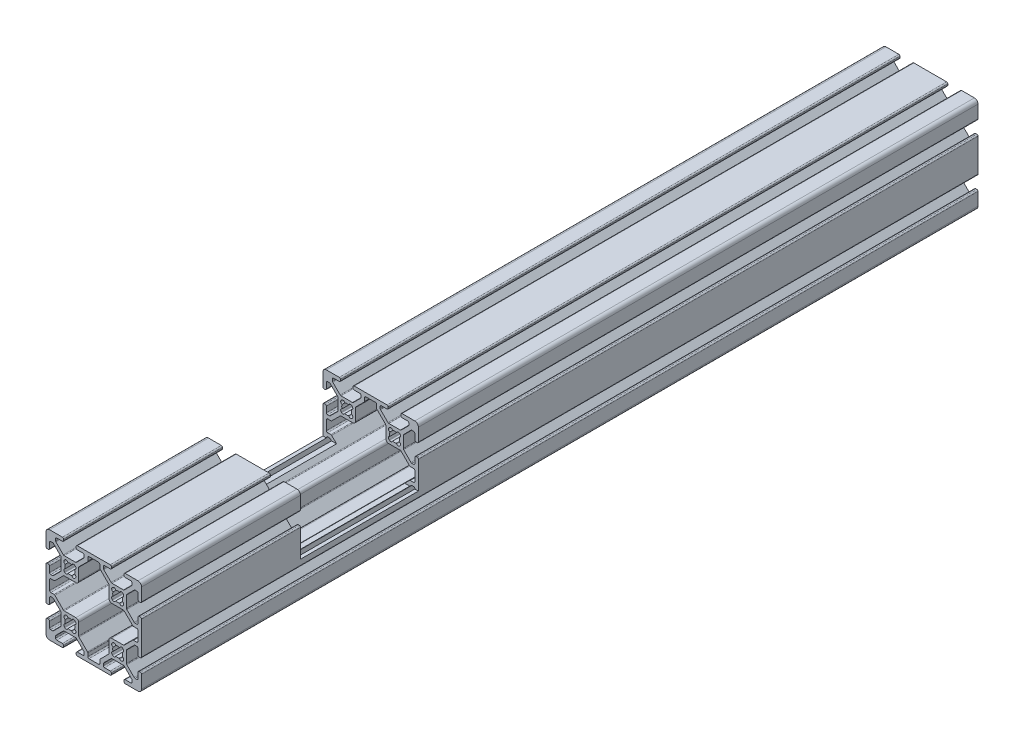
from build123d import *

# Parameters (mm, degrees)
EXTRUDE1_DEPTH     = 350
SKETCH2_W          = 49.355199135
SKETCH2_H          = 28.504685617
CUT_EXTRUDE1_DEPTH = 54


with BuildPart() as part:
    # Sketch1 → Extrude1 (new body)
    with BuildSketch(Plane.XY):
        with BuildLine():
            Line((-22.383919339, -3.655), (-17.616080661, -3.655))
            ThreePointArc((-17.616080661, -3.655), (-17.421677478, -3.693669197), (-17.256870417, -3.803789755))
            Line((-17.256870417, -3.803789755), (-14.153789755, -6.906870417))
            ThreePointArc((-14.153789755, -6.906870417), (-14.043669197, -7.071677478), (-14.005, -7.266080661))
            Line((-14.005, -7.266080661), (-14.005, -7.992))
            ThreePointArc((-14.005, -7.992), (-14.153789755, -8.351210245), (-14.513, -8.5))
            Line((-14.513, -8.5), (-16.862, -8.5))
            ThreePointArc((-16.862, -8.5), (-17.221210245, -8.648789755), (-17.37, -9.008))
            Line((-17.37, -9.008), (-17.37, -9.492))
            ThreePointArc((-17.37, -9.492), (-17.221210245, -9.851210245), (-16.862, -10))
            Line((-16.862, -10), (-3.138, -10))
            ThreePointArc((-3.138, -10), (-2.778789755, -9.851210245), (-2.63, -9.492))
            Line((-2.63, -9.492), (-2.63, -9.008))
            ThreePointArc((-2.63, -9.008), (-2.778789755, -8.648789755), (-3.138, -8.5))
            Line((-3.138, -8.5), (-5.487, -8.5))
            ThreePointArc((-5.487, -8.5), (-5.846210245, -8.351210245), (-5.995, -7.992))
            Line((-5.995, -7.992), (-5.995, -7.266080661))
            ThreePointArc((-5.995, -7.266080661), (-5.956330803, -7.071677478), (-5.846210245, -6.906870417))
            Line((-5.846210245, -6.906870417), (-2.743129583, -3.803789755))
            ThreePointArc((-2.743129583, -3.803789755), (-2.578322522, -3.693669197), (-2.383919339, -3.655))
            Line((-2.383919339, -3.655), (2.383919339, -3.655))
            ThreePointArc((2.383919339, -3.655), (2.578322522, -3.693669197), (2.743129583, -3.803789755))
            Line((2.743129583, -3.803789755), (5.846210245, -6.906870417))
            ThreePointArc((5.846210245, -6.906870417), (5.956330803, -7.071677478), (5.995, -7.266080661))
            Line((5.995, -7.266080661), (5.995, -7.992))
            ThreePointArc((5.995, -7.992), (5.846210245, -8.351210245), (5.487, -8.5))
            Line((5.487, -8.5), (3.138, -8.5))
            ThreePointArc((3.138, -8.5), (2.778789755, -8.648789755), (2.63, -9.008))
            Line((2.63, -9.008), (2.63, -9.492))
            ThreePointArc((2.63, -9.492), (2.778789755, -9.851210245), (3.138, -10))
            Line((3.138, -10), (8.5, -10))
            ThreePointArc((8.5, -10), (9.560660172, -9.560660172), (10, -8.5))
            Line((10, -8.5), (10, -3.138))
            ThreePointArc((10, -3.138), (9.851210245, -2.778789755), (9.492, -2.63))
            Line((9.492, -2.63), (9.008, -2.63))
            ThreePointArc((9.008, -2.63), (8.648789755, -2.778789755), (8.5, -3.138))
            Line((8.5, -3.138), (8.5, -5.487))
            ThreePointArc((8.5, -5.487), (8.351210245, -5.846210245), (7.992, -5.995))
            Line((7.992, -5.995), (7.266080661, -5.995))
            ThreePointArc((7.266080661, -5.995), (7.071677478, -5.956330803), (6.906870417, -5.846210245))
            Line((6.906870417, -5.846210245), (3.803789755, -2.743129583))
            ThreePointArc((3.803789755, -2.743129583), (3.693669197, -2.578322522), (3.655, -2.383919339))
            Line((3.655, -2.383919339), (3.655, 2.383919339))
            ThreePointArc((3.655, 2.383919339), (3.693669197, 2.578322522), (3.803789755, 2.743129583))
            Line((3.803789755, 2.743129583), (6.906870417, 5.846210245))
            ThreePointArc((6.906870417, 5.846210245), (7.071677478, 5.956330803), (7.266080661, 5.995))
            Line((7.266080661, 5.995), (7.992, 5.995))
            ThreePointArc((7.992, 5.995), (8.351210245, 5.846210245), (8.5, 5.487))
            Line((8.5, 5.487), (8.5, 3.138))
            ThreePointArc((8.5, 3.138), (8.648789755, 2.778789755), (9.008, 2.63))
            Line((9.008, 2.63), (9.492, 2.63))
            ThreePointArc((9.492, 2.63), (9.851210245, 2.778789755), (10, 3.138))
            Line((10, 3.138), (10, 16.862))
            ThreePointArc((10, 16.862), (9.851210245, 17.221210245), (9.492, 17.37))
            Line((9.492, 17.37), (9.008, 17.37))
            ThreePointArc((9.008, 17.37), (8.648789755, 17.221210245), (8.5, 16.862))
            Line((8.5, 16.862), (8.5, 14.513))
            ThreePointArc((8.5, 14.513), (8.351210245, 14.153789755), (7.992, 14.005))
            Line((7.992, 14.005), (7.266080661, 14.005))
            ThreePointArc((7.266080661, 14.005), (7.071677478, 14.043669197), (6.906870417, 14.153789755))
            Line((6.906870417, 14.153789755), (3.803789755, 17.256870417))
            ThreePointArc((3.803789755, 17.256870417), (3.693669197, 17.421677478), (3.655, 17.616080661))
            Line((3.655, 17.616080661), (3.655, 22.383919339))
            ThreePointArc((3.655, 22.383919339), (3.693669197, 22.578322522), (3.803789755, 22.743129583))
            Line((3.803789755, 22.743129583), (6.906870417, 25.846210245))
            ThreePointArc((6.906870417, 25.846210245), (7.071677478, 25.956330803), (7.266080661, 25.995))
            Line((7.266080661, 25.995), (7.992, 25.995))
            ThreePointArc((7.992, 25.995), (8.351210245, 25.846210245), (8.5, 25.487))
            Line((8.5, 25.487), (8.5, 23.138))
            ThreePointArc((8.5, 23.138), (8.648789755, 22.778789755), (9.008, 22.63))
            Line((9.008, 22.63), (9.492, 22.63))
            ThreePointArc((9.492, 22.63), (9.851210245, 22.778789755), (10, 23.138))
            Line((10, 23.138), (10, 28.5))
            ThreePointArc((10, 28.5), (9.560660172, 29.560660172), (8.5, 30))
            Line((8.5, 30), (3.138, 30))
            ThreePointArc((3.138, 30), (2.778789755, 29.851210245), (2.63, 29.492))
            Line((2.63, 29.492), (2.63, 29.008))
            ThreePointArc((2.63, 29.008), (2.778789755, 28.648789755), (3.138, 28.5))
            Line((3.138, 28.5), (5.487, 28.5))
            ThreePointArc((5.487, 28.5), (5.846210245, 28.351210245), (5.995, 27.992))
            Line((5.995, 27.992), (5.995, 27.266080661))
            ThreePointArc((5.995, 27.266080661), (5.956330803, 27.071677478), (5.846210245, 26.906870417))
            Line((5.846210245, 26.906870417), (2.743129583, 23.803789755))
            ThreePointArc((2.743129583, 23.803789755), (2.578322522, 23.693669197), (2.383919339, 23.655))
            Line((2.383919339, 23.655), (-2.383919339, 23.655))
            ThreePointArc((-2.383919339, 23.655), (-2.578322522, 23.693669197), (-2.743129583, 23.803789755))
            Line((-2.743129583, 23.803789755), (-5.846210245, 26.906870417))
            ThreePointArc((-5.846210245, 26.906870417), (-5.956330803, 27.071677478), (-5.995, 27.266080661))
            Line((-5.995, 27.266080661), (-5.995, 27.992))
            ThreePointArc((-5.995, 27.992), (-5.846210245, 28.351210245), (-5.487, 28.5))
            Line((-5.487, 28.5), (-3.138, 28.5))
            ThreePointArc((-3.138, 28.5), (-2.778789755, 28.648789755), (-2.63, 29.008))
            Line((-2.63, 29.008), (-2.63, 29.492))
            ThreePointArc((-2.63, 29.492), (-2.778789755, 29.851210245), (-3.138, 30))
            Line((-3.138, 30), (-16.862, 30))
            ThreePointArc((-16.862, 30), (-17.221210245, 29.851210245), (-17.37, 29.492))
            Line((-17.37, 29.492), (-17.37, 29.008))
            ThreePointArc((-17.37, 29.008), (-17.221210245, 28.648789755), (-16.862, 28.5))
            Line((-16.862, 28.5), (-14.513, 28.5))
            ThreePointArc((-14.513, 28.5), (-14.153789755, 28.351210245), (-14.005, 27.992))
            Line((-14.005, 27.992), (-14.005, 27.266080661))
            ThreePointArc((-14.005, 27.266080661), (-14.043669197, 27.071677478), (-14.153789755, 26.906870417))
            Line((-14.153789755, 26.906870417), (-17.256870417, 23.803789755))
            ThreePointArc((-17.256870417, 23.803789755), (-17.421677478, 23.693669197), (-17.616080661, 23.655))
            Line((-17.616080661, 23.655), (-22.383919339, 23.655))
            ThreePointArc((-22.383919339, 23.655), (-22.578322522, 23.693669197), (-22.743129583, 23.803789755))
            Line((-22.743129583, 23.803789755), (-25.846210245, 26.906870417))
            ThreePointArc((-25.846210245, 26.906870417), (-25.956330803, 27.071677478), (-25.995, 27.266080661))
            Line((-25.995, 27.266080661), (-25.995, 27.992))
            ThreePointArc((-25.995, 27.992), (-25.846210245, 28.351210245), (-25.487, 28.5))
            Line((-25.487, 28.5), (-23.138, 28.5))
            ThreePointArc((-23.138, 28.5), (-22.778789755, 28.648789755), (-22.63, 29.008))
            Line((-22.63, 29.008), (-22.63, 29.492))
            ThreePointArc((-22.63, 29.492), (-22.778789755, 29.851210245), (-23.138, 30))
            Line((-23.138, 30), (-28.5, 30))
            ThreePointArc((-28.5, 30), (-29.560660172, 29.560660172), (-30, 28.5))
            Line((-30, 28.5), (-30, 23.138))
            ThreePointArc((-30, 23.138), (-29.851210245, 22.778789755), (-29.492, 22.63))
            Line((-29.492, 22.63), (-29.008, 22.63))
            ThreePointArc((-29.008, 22.63), (-28.648789755, 22.778789755), (-28.5, 23.138))
            Line((-28.5, 23.138), (-28.5, 25.487))
            ThreePointArc((-28.5, 25.487), (-28.351210245, 25.846210245), (-27.992, 25.995))
            Line((-27.992, 25.995), (-27.266080661, 25.995))
            ThreePointArc((-27.266080661, 25.995), (-27.071677478, 25.956330803), (-26.906870417, 25.846210245))
            Line((-26.906870417, 25.846210245), (-23.803789755, 22.743129583))
            ThreePointArc((-23.803789755, 22.743129583), (-23.693669197, 22.578322522), (-23.655, 22.383919339))
            Line((-23.655, 22.383919339), (-23.655, 17.616080661))
            ThreePointArc((-23.655, 17.616080661), (-23.693669197, 17.421677478), (-23.803789755, 17.256870417))
            Line((-23.803789755, 17.256870417), (-26.906870417, 14.153789755))
            ThreePointArc((-26.906870417, 14.153789755), (-27.071677478, 14.043669197), (-27.266080661, 14.005))
            Line((-27.266080661, 14.005), (-27.992, 14.005))
            ThreePointArc((-27.992, 14.005), (-28.351210245, 14.153789755), (-28.5, 14.513))
            Line((-28.5, 14.513), (-28.5, 16.862))
            ThreePointArc((-28.5, 16.862), (-28.648789755, 17.221210245), (-29.008, 17.37))
            Line((-29.008, 17.37), (-29.492, 17.37))
            ThreePointArc((-29.492, 17.37), (-29.851210245, 17.221210245), (-30, 16.862))
            Line((-30, 16.862), (-30, 3.138))
            ThreePointArc((-30, 3.138), (-29.851210245, 2.778789755), (-29.492, 2.63))
            Line((-29.492, 2.63), (-29.008, 2.63))
            ThreePointArc((-29.008, 2.63), (-28.648789755, 2.778789755), (-28.5, 3.138))
            Line((-28.5, 3.138), (-28.5, 5.487))
            ThreePointArc((-28.5, 5.487), (-28.351210245, 5.846210245), (-27.992, 5.995))
            Line((-27.992, 5.995), (-27.266080661, 5.995))
            ThreePointArc((-27.266080661, 5.995), (-27.071677478, 5.956330803), (-26.906870417, 5.846210245))
            Line((-26.906870417, 5.846210245), (-23.803789755, 2.743129583))
            ThreePointArc((-23.803789755, 2.743129583), (-23.693669197, 2.578322522), (-23.655, 2.383919339))
            Line((-23.655, 2.383919339), (-23.655, -2.383919339))
            ThreePointArc((-23.655, -2.383919339), (-23.693669197, -2.578322522), (-23.803789755, -2.743129583))
            Line((-23.803789755, -2.743129583), (-26.906870417, -5.846210245))
            ThreePointArc((-26.906870417, -5.846210245), (-27.071677478, -5.956330803), (-27.266080661, -5.995))
            Line((-27.266080661, -5.995), (-27.992, -5.995))
            ThreePointArc((-27.992, -5.995), (-28.351210245, -5.846210245), (-28.5, -5.487))
            Line((-28.5, -5.487), (-28.5, -3.138))
            ThreePointArc((-28.5, -3.138), (-28.648789755, -2.778789755), (-29.008, -2.63))
            Line((-29.008, -2.63), (-29.492, -2.63))
            ThreePointArc((-29.492, -2.63), (-29.851210245, -2.778789755), (-30, -3.138))
            Line((-30, -3.138), (-30, -8.5))
            ThreePointArc((-30, -8.5), (-29.560660172, -9.560660172), (-28.5, -10))
            Line((-28.5, -10), (-23.138, -10))
            ThreePointArc((-23.138, -10), (-22.778789755, -9.851210245), (-22.63, -9.492))
            Line((-22.63, -9.492), (-22.63, -9.008))
            ThreePointArc((-22.63, -9.008), (-22.778789755, -8.648789755), (-23.138, -8.5))
            Line((-23.138, -8.5), (-25.487, -8.5))
            ThreePointArc((-25.487, -8.5), (-25.846210245, -8.351210245), (-25.995, -7.992))
            Line((-25.995, -7.992), (-25.995, -7.266080661))
            ThreePointArc((-25.995, -7.266080661), (-25.956330803, -7.071677478), (-25.846210245, -6.906870417))
            Line((-25.846210245, -6.906870417), (-22.743129583, -3.803789755))
            ThreePointArc((-22.743129583, -3.803789755), (-22.578322522, -3.693669197), (-22.383919339, -3.655))
        make_face()
        with BuildLine():
            Line((-2.124900844, 17.695494034), (-2.304505966, 17.875099156))
            ThreePointArc((-2.304505966, 17.875099156), (-2.505938017, 18.643532189), (-1.935133506, 19.196023282))
            ThreePointArc((-1.935133506, 19.196023282), (-2.0955, 20), (-1.935133506, 20.803976718))
            ThreePointArc((-1.935133506, 20.803976718), (-2.505938017, 21.356467811), (-2.304505966, 22.124900844))
            Line((-2.304505966, 22.124900844), (-2.124900844, 22.304505966))
            ThreePointArc((-2.124900844, 22.304505966), (-1.356467811, 22.505938017), (-0.803976718, 21.935133506))
            ThreePointArc((-0.803976718, 21.935133506), (0, 22.0955), (0.803976718, 21.935133506))
            ThreePointArc((0.803976718, 21.935133506), (1.356467811, 22.505938017), (2.124900844, 22.304505966))
            Line((2.124900844, 22.304505966), (2.304505966, 22.124900844))
            ThreePointArc((2.304505966, 22.124900844), (2.505938017, 21.356467811), (1.935133506, 20.803976718))
            ThreePointArc((1.935133506, 20.803976718), (2.0955, 20), (1.935133506, 19.196023282))
            ThreePointArc((1.935133506, 19.196023282), (2.505938017, 18.643532189), (2.304505966, 17.875099156))
            Line((2.304505966, 17.875099156), (2.124900844, 17.695494034))
            ThreePointArc((2.124900844, 17.695494034), (1.356467811, 17.494061983), (0.803976718, 18.064866494))
            ThreePointArc((0.803976718, 18.064866494), (0, 17.9045), (-0.803976718, 18.064866494))
            ThreePointArc((-0.803976718, 18.064866494), (-1.356467811, 17.494061983), (-2.124900844, 17.695494034))
        make_face(mode=Mode.SUBTRACT)
        with BuildLine():
            Line((-22.124900844, 17.695494034), (-22.304505966, 17.875099156))
            ThreePointArc((-22.304505966, 17.875099156), (-22.505938017, 18.643532189), (-21.935133506, 19.196023282))
            ThreePointArc((-21.935133506, 19.196023282), (-22.0955, 20), (-21.935133506, 20.803976718))
            ThreePointArc((-21.935133506, 20.803976718), (-22.505938017, 21.356467811), (-22.304505966, 22.124900844))
            Line((-22.304505966, 22.124900844), (-22.124900844, 22.304505966))
            ThreePointArc((-22.124900844, 22.304505966), (-21.356467811, 22.505938017), (-20.803976718, 21.935133506))
            ThreePointArc((-20.803976718, 21.935133506), (-20, 22.0955), (-19.196023282, 21.935133506))
            ThreePointArc((-19.196023282, 21.935133506), (-18.643532189, 22.505938017), (-17.875099156, 22.304505966))
            Line((-17.875099156, 22.304505966), (-17.695494034, 22.124900844))
            ThreePointArc((-17.695494034, 22.124900844), (-17.494061983, 21.356467811), (-18.064866494, 20.803976718))
            ThreePointArc((-18.064866494, 20.803976718), (-17.9045, 20), (-18.064866494, 19.196023282))
            ThreePointArc((-18.064866494, 19.196023282), (-17.494061983, 18.643532189), (-17.695494034, 17.875099156))
            Line((-17.695494034, 17.875099156), (-17.875099156, 17.695494034))
            ThreePointArc((-17.875099156, 17.695494034), (-18.643532189, 17.494061983), (-19.196023282, 18.064866494))
            ThreePointArc((-19.196023282, 18.064866494), (-20, 17.9045), (-20.803976718, 18.064866494))
            ThreePointArc((-20.803976718, 18.064866494), (-21.356467811, 17.494061983), (-22.124900844, 17.695494034))
        make_face(mode=Mode.SUBTRACT)
        with BuildLine():
            Line((-2.124900844, -2.304505966), (-2.304505966, -2.124900844))
            ThreePointArc((-2.304505966, -2.124900844), (-2.505938017, -1.356467811), (-1.935133506, -0.803976718))
            ThreePointArc((-1.935133506, -0.803976718), (-2.0955, 0), (-1.935133506, 0.803976718))
            ThreePointArc((-1.935133506, 0.803976718), (-2.505938017, 1.356467811), (-2.304505966, 2.124900844))
            Line((-2.304505966, 2.124900844), (-2.124900844, 2.304505966))
            ThreePointArc((-2.124900844, 2.304505966), (-1.356467811, 2.505938017), (-0.803976718, 1.935133506))
            ThreePointArc((-0.803976718, 1.935133506), (0, 2.0955), (0.803976718, 1.935133506))
            ThreePointArc((0.803976718, 1.935133506), (1.356467811, 2.505938017), (2.124900844, 2.304505966))
            Line((2.124900844, 2.304505966), (2.304505966, 2.124900844))
            ThreePointArc((2.304505966, 2.124900844), (2.505938017, 1.356467811), (1.935133506, 0.803976718))
            ThreePointArc((1.935133506, 0.803976718), (2.0955, 0), (1.935133506, -0.803976718))
            ThreePointArc((1.935133506, -0.803976718), (2.505938017, -1.356467811), (2.304505966, -2.124900844))
            Line((2.304505966, -2.124900844), (2.124900844, -2.304505966))
            ThreePointArc((2.124900844, -2.304505966), (1.356467811, -2.505938017), (0.803976718, -1.935133506))
            ThreePointArc((0.803976718, -1.935133506), (0, -2.0955), (-0.803976718, -1.935133506))
            ThreePointArc((-0.803976718, -1.935133506), (-1.356467811, -2.505938017), (-2.124900844, -2.304505966))
        make_face(mode=Mode.SUBTRACT)
        with BuildLine():
            Line((-12.505, -7.992), (-12.505, -6.644760318))
            ThreePointArc((-12.505, -6.644760318), (-12.543669197, -6.450357134), (-12.653789755, -6.285550073))
            Line((-12.653789755, -6.285550073), (-16.196210245, -2.743129583))
            ThreePointArc((-16.196210245, -2.743129583), (-16.306330803, -2.578322522), (-16.345, -2.383919339))
            Line((-16.345, -2.383919339), (-16.345, 2.512))
            ThreePointArc((-16.345, 2.512), (-16.679776949, 3.320223051), (-17.488, 3.655))
            Line((-17.488, 3.655), (-22.383919339, 3.655))
            ThreePointArc((-22.383919339, 3.655), (-22.578322522, 3.693669197), (-22.743129583, 3.803789755))
            Line((-22.743129583, 3.803789755), (-26.285550073, 7.346210245))
            ThreePointArc((-26.285550073, 7.346210245), (-26.450357134, 7.456330803), (-26.644760318, 7.495))
            Line((-26.644760318, 7.495), (-27.992, 7.495))
            ThreePointArc((-27.992, 7.495), (-28.351210245, 7.643789755), (-28.5, 8.003))
            Line((-28.5, 8.003), (-28.5, 11.997))
            ThreePointArc((-28.5, 11.997), (-28.351210245, 12.356210245), (-27.992, 12.505))
            Line((-27.992, 12.505), (-26.644760318, 12.505))
            ThreePointArc((-26.644760318, 12.505), (-26.450357134, 12.543669197), (-26.285550073, 12.653789755))
            Line((-26.285550073, 12.653789755), (-22.743129583, 16.196210245))
            ThreePointArc((-22.743129583, 16.196210245), (-22.578322522, 16.306330803), (-22.383919339, 16.345))
            Line((-22.383919339, 16.345), (-17.488, 16.345))
            ThreePointArc((-17.488, 16.345), (-16.679776949, 16.679776949), (-16.345, 17.488))
            Line((-16.345, 17.488), (-16.345, 22.383919339))
            ThreePointArc((-16.345, 22.383919339), (-16.306330803, 22.578322522), (-16.196210245, 22.743129583))
            Line((-16.196210245, 22.743129583), (-12.653789755, 26.285550073))
            ThreePointArc((-12.653789755, 26.285550073), (-12.543669197, 26.450357134), (-12.505, 26.644760318))
            Line((-12.505, 26.644760318), (-12.505, 27.992))
            ThreePointArc((-12.505, 27.992), (-12.356210245, 28.351210245), (-11.997, 28.5))
            Line((-11.997, 28.5), (-8.003, 28.5))
            ThreePointArc((-8.003, 28.5), (-7.643789755, 28.351210245), (-7.495, 27.992))
            Line((-7.495, 27.992), (-7.495, 26.644760318))
            ThreePointArc((-7.495, 26.644760318), (-7.456330803, 26.450357134), (-7.346210245, 26.285550073))
            Line((-7.346210245, 26.285550073), (-3.803789755, 22.743129583))
            ThreePointArc((-3.803789755, 22.743129583), (-3.693669197, 22.578322522), (-3.655, 22.383919339))
            Line((-3.655, 22.383919339), (-3.655, 17.488))
            ThreePointArc((-3.655, 17.488), (-3.320223051, 16.679776949), (-2.512, 16.345))
            Line((-2.512, 16.345), (2.383919339, 16.345))
            ThreePointArc((2.383919339, 16.345), (2.578322522, 16.306330803), (2.743129583, 16.196210245))
            Line((2.743129583, 16.196210245), (6.285550073, 12.653789755))
            ThreePointArc((6.285550073, 12.653789755), (6.450357134, 12.543669197), (6.644760318, 12.505))
            Line((6.644760318, 12.505), (7.992, 12.505))
            ThreePointArc((7.992, 12.505), (8.351210245, 12.356210245), (8.5, 11.997))
            Line((8.5, 11.997), (8.5, 8.003))
            ThreePointArc((8.5, 8.003), (8.351210245, 7.643789755), (7.992, 7.495))
            Line((7.992, 7.495), (6.644760318, 7.495))
            ThreePointArc((6.644760318, 7.495), (6.450357134, 7.456330803), (6.285550073, 7.346210245))
            Line((6.285550073, 7.346210245), (2.743129583, 3.803789755))
            ThreePointArc((2.743129583, 3.803789755), (2.578322522, 3.693669197), (2.383919339, 3.655))
            Line((2.383919339, 3.655), (-2.512, 3.655))
            ThreePointArc((-2.512, 3.655), (-3.320223051, 3.320223051), (-3.655, 2.512))
            Line((-3.655, 2.512), (-3.655, -2.383919339))
            ThreePointArc((-3.655, -2.383919339), (-3.693669197, -2.578322522), (-3.803789755, -2.743129583))
            Line((-3.803789755, -2.743129583), (-7.346210245, -6.285550073))
            ThreePointArc((-7.346210245, -6.285550073), (-7.456330803, -6.450357134), (-7.495, -6.644760318))
            Line((-7.495, -6.644760318), (-7.495, -7.992))
            ThreePointArc((-7.495, -7.992), (-7.643789755, -8.351210245), (-8.003, -8.5))
            Line((-8.003, -8.5), (-11.997, -8.5))
            ThreePointArc((-11.997, -8.5), (-12.356210245, -8.351210245), (-12.505, -7.992))
        make_face(mode=Mode.SUBTRACT)
        with BuildLine():
            Line((-22.124900844, -2.304505966), (-22.304505966, -2.124900844))
            ThreePointArc((-22.304505966, -2.124900844), (-22.505938017, -1.356467811), (-21.935133506, -0.803976718))
            ThreePointArc((-21.935133506, -0.803976718), (-22.0955, 0), (-21.935133506, 0.803976718))
            ThreePointArc((-21.935133506, 0.803976718), (-22.505938017, 1.356467811), (-22.304505966, 2.124900844))
            Line((-22.304505966, 2.124900844), (-22.124900844, 2.304505966))
            ThreePointArc((-22.124900844, 2.304505966), (-21.356467811, 2.505938017), (-20.803976718, 1.935133506))
            ThreePointArc((-20.803976718, 1.935133506), (-20, 2.0955), (-19.196023282, 1.935133506))
            ThreePointArc((-19.196023282, 1.935133506), (-18.643532189, 2.505938017), (-17.875099156, 2.304505966))
            Line((-17.875099156, 2.304505966), (-17.695494034, 2.124900844))
            ThreePointArc((-17.695494034, 2.124900844), (-17.494061983, 1.356467811), (-18.064866494, 0.803976718))
            ThreePointArc((-18.064866494, 0.803976718), (-17.9045, 0), (-18.064866494, -0.803976718))
            ThreePointArc((-18.064866494, -0.803976718), (-17.494061983, -1.356467811), (-17.695494034, -2.124900844))
            Line((-17.695494034, -2.124900844), (-17.875099156, -2.304505966))
            ThreePointArc((-17.875099156, -2.304505966), (-18.643532189, -2.505938017), (-19.196023282, -1.935133506))
            ThreePointArc((-19.196023282, -1.935133506), (-20, -2.0955), (-20.803976718, -1.935133506))
            ThreePointArc((-20.803976718, -1.935133506), (-21.356467811, -2.505938017), (-22.124900844, -2.304505966))
        make_face(mode=Mode.SUBTRACT)
    extrude(amount=-EXTRUDE1_DEPTH)

    # Sketch2 → Cut-Extrude1 (cut)
    with BuildSketch(Plane(origin=(10, 0, 0), x_dir=(0, 0, -1), z_dir=(1, 0, 0))):
        with Locations((91.164143133, 19.581507494)):
            Rectangle(SKETCH2_W, SKETCH2_H)
    extrude(amount=-CUT_EXTRUDE1_DEPTH, mode=Mode.SUBTRACT)


solid = part.part
